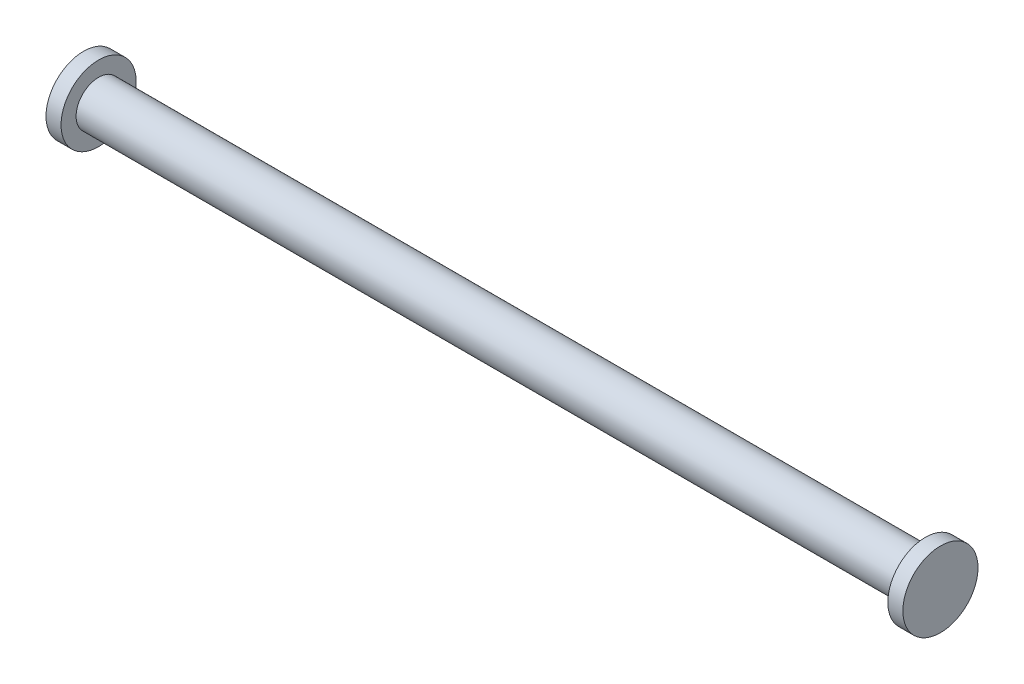
from build123d import *

# Parameters (mm, degrees)
SKETCH1_R           = 3.81
BOSS_EXTRUDE1_DEPTH = 139.7
SKETCH2_R           = 6.35
BOSS_EXTRUDE2_DEPTH = 2.54
BOSS_EXTRUDE3_START = 2.54
SKETCH3_R           = 6.35
BOSS_EXTRUDE3_DEPTH = 2.54


with BuildPart() as part:
    # Sketch1 → Boss-Extrude1 (new body)
    with BuildSketch(Plane(origin=(0, 0, 0), x_dir=(0, 0, -1), z_dir=(1, 0, 0))):
        Circle(SKETCH1_R)
    extrude(amount=BOSS_EXTRUDE1_DEPTH)

    # Sketch2 → Boss-Extrude2 (add)
    with BuildSketch(Plane(origin=(139.7, 0, 0), x_dir=(0, 0, -1), z_dir=(1, 0, 0))):
        Circle(SKETCH2_R)
    extrude(amount=BOSS_EXTRUDE2_DEPTH)

    # Sketch3 → Boss-Extrude3 (add)
    with BuildSketch(Plane.ZY.offset(BOSS_EXTRUDE3_START)):
        with Locations(Location((0, 0, 0), (0, 0, 180))):
            Circle(SKETCH3_R)
    extrude(amount=-BOSS_EXTRUDE3_DEPTH)


solid = part.part
